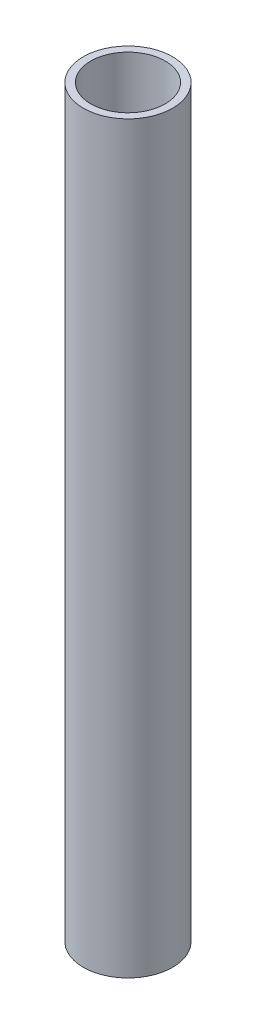
from build123d import *

# Parameters (mm, degrees)
SKETCH1_R   = 15.24
SKETCH1_R_2 = 12.7


with BuildPart() as part:
    # Sweep1: sweep along a curve in space
    with BuildLine() as sweep1_path:
        Line((0, 0, 0), (0, -254, 0))
    # Sketch1 → Sweep1 (sweep)
    with BuildSketch(Plane(origin=(0, 0, 0), x_dir=(1, 0, 0), z_dir=(0, 1, 0))):
        Circle(SKETCH1_R)
        Circle(SKETCH1_R_2, mode=Mode.SUBTRACT)
    sweep(path=sweep1_path.line)


solid = part.part
